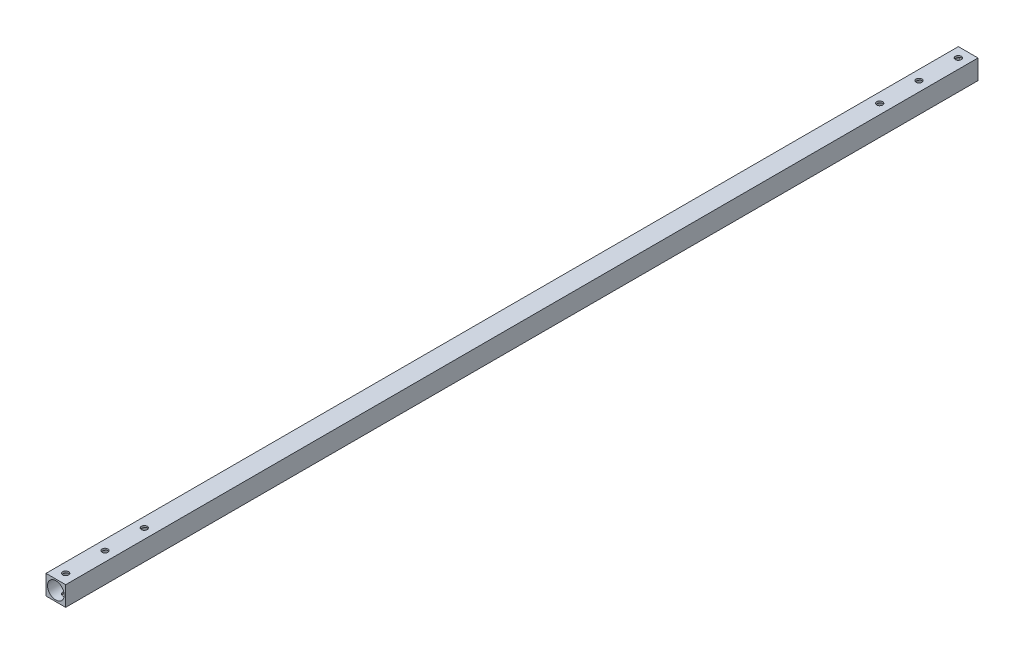
from build123d import *

# Parameters (mm, degrees)
SKETCH1_W           = 10
SKETCH1_H           = 10
SKETCH1_R           = 4.25
BOSS_EXTRUDE1_DEPTH = 464
SKETCH2_R           = 1.5
CUT_EXTRUDE1_DEPTH  = 465.13467873


with BuildPart() as part:
    # Sketch1 → Boss-Extrude1 (new body)
    with BuildSketch(Plane.XY):
        Rectangle(SKETCH1_W, SKETCH1_H)
        with Locations(Location((0, 0, 0), (0, 0, 180))):
            Circle(SKETCH1_R, mode=Mode.SUBTRACT)
    extrude(amount=BOSS_EXTRUDE1_DEPTH)

    # Sketch2 → Cut-Extrude1 (cut, through all)
    with BuildSketch(Plane(origin=(0, 5, 0), x_dir=(1, 0, 0), z_dir=(0, 1, 0))):
        with Locations(Location((0, -5, 0), (0, 0, 270))):
            Circle(SKETCH2_R)
        with Locations(Location((0, -25, 0), (0, 0, 270))):
            Circle(SKETCH2_R)
        with Locations(Location((0, -45, 0), (0, 0, 270))):
            Circle(SKETCH2_R)
        with Locations(Location((0, -459, 0), (0, 0, 270))):
            Circle(SKETCH2_R)
        with Locations(Location((0, -439, 0), (0, 0, 270))):
            Circle(SKETCH2_R)
        with Locations(Location((0, -419, 0), (0, 0, 270))):
            Circle(SKETCH2_R)
    extrude(amount=-CUT_EXTRUDE1_DEPTH, mode=Mode.SUBTRACT)


solid = part.part
